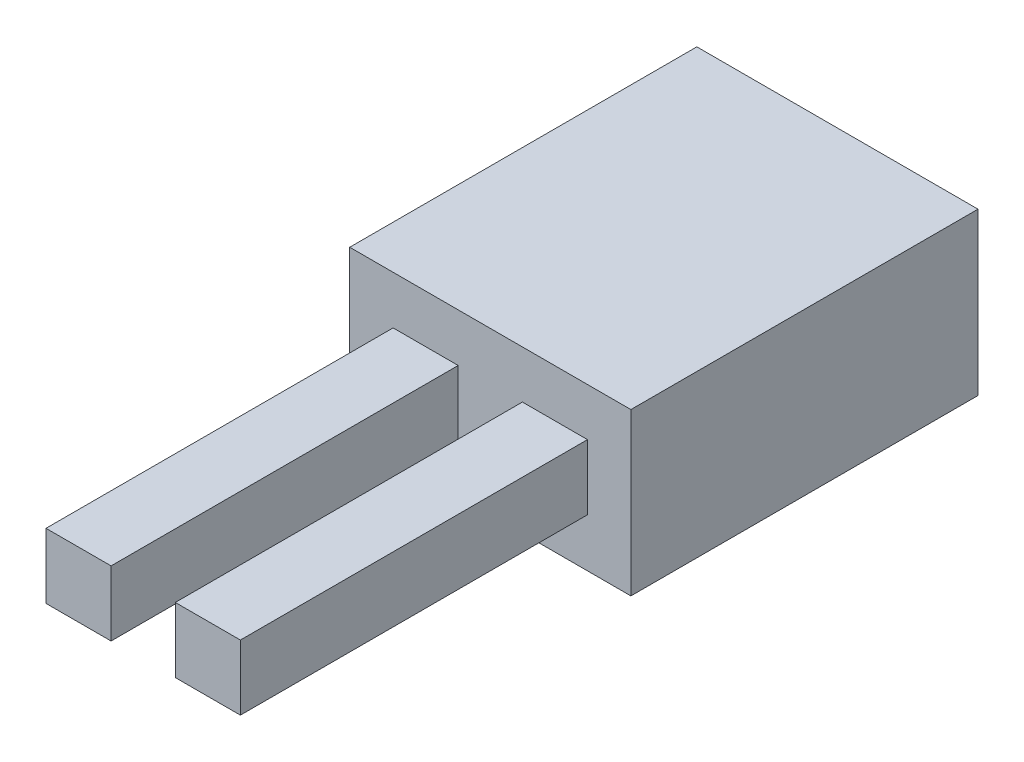
from build123d import *

# Parameters (mm, degrees)
SKETCH1_W           = 3.24
SKETCH1_H           = 4
BOSS_EXTRUDE1_DEPTH = 1.86
SKETCH2_W           = 0.75
SKETCH2_H           = 0.75
BOSS_EXTRUDE2_DEPTH = 4


with BuildPart() as part:
    # Sketch1 → Boss-Extrude1 (new body)
    with BuildSketch(Plane(origin=(0, 0, 0), x_dir=(1, 0, 0), z_dir=(0, 1, 0))):
        with Locations((1.62, 2)):
            Rectangle(SKETCH1_W, SKETCH1_H)
    extrude(amount=BOSS_EXTRUDE1_DEPTH)

    # Sketch2 → Boss-Extrude2 (add)
    with BuildSketch(Plane.XY):
        with Locations((0.875, 0.93)):
            Rectangle(SKETCH2_W, SKETCH2_H)
        with Locations((2.365, 0.935)):
            Rectangle(SKETCH2_W, SKETCH2_H)
    extrude(amount=BOSS_EXTRUDE2_DEPTH)


solid = part.part
